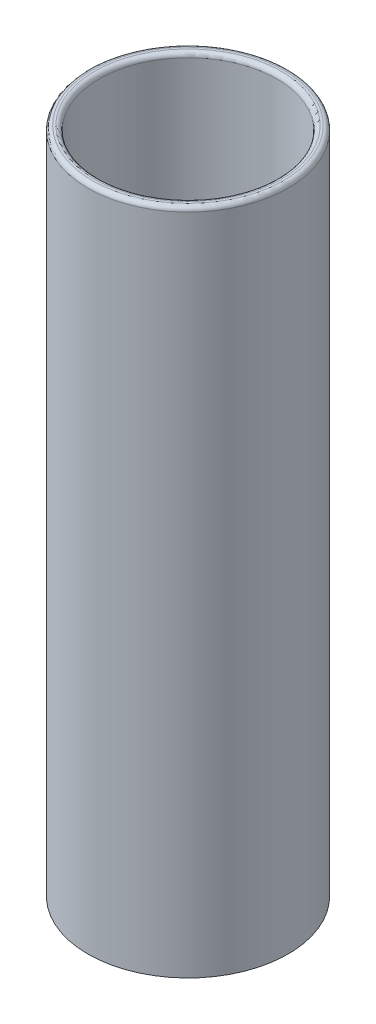
from build123d import *

# Parameters (mm, degrees)
SKETCH1_R           = 22.5
BOSS_EXTRUDE1_DEPTH = 150
SKETCH2_R           = 20
CUT_EXTRUDE1_DEPTH  = 140
FILLET2_R           = 1


with BuildPart() as part:
    # Sketch1 → Boss-Extrude1 (new body)
    with BuildSketch(Plane(origin=(0, 0, 0), x_dir=(1, 0, 0), z_dir=(0, 1, 0))):
        with Locations(Location((0, 0, 0), (0, 0, 270))):
            Circle(SKETCH1_R)
    extrude(amount=BOSS_EXTRUDE1_DEPTH)

    # Sketch2 → Cut-Extrude1 (cut)
    with BuildSketch(Plane(origin=(0, 150, 0), x_dir=(1, 0, 0), z_dir=(0, 1, 0))):
        with Locations(Location((0, 0, 0), (0, 0, 270))):
            Circle(SKETCH2_R)
    extrude(amount=-CUT_EXTRUDE1_DEPTH, mode=Mode.SUBTRACT)

    # Fillet2
    fillet2_edges = [part.edges().sort_by_distance(p)[0] for p in [
        (0, 150, -22.5),
        (0, 150, -20),
    ]]
    fillet(fillet2_edges, radius=FILLET2_R)


solid = part.part
